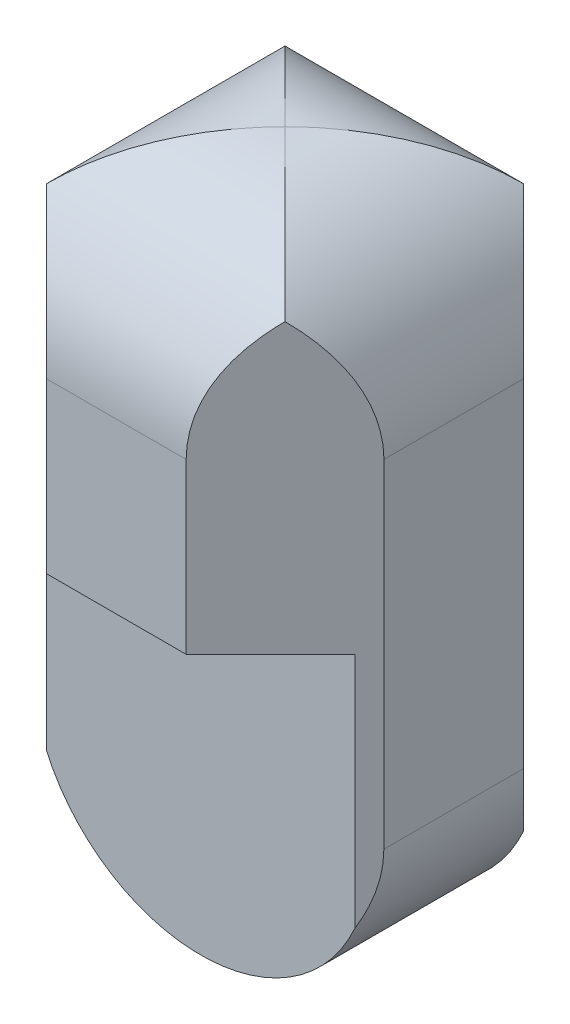
from build123d import *

# Parameters (mm, degrees)
EXTRUDE_1_DEPTH     = 48
CUT_EXTRUDE_1_DEPTH = 66
CUT_EXTRUDE_2_DEPTH = 5
CUT_EXTRUDE_START   = -5
CUT_EXTRUDE_3_DEPTH = 5
CUT_EXTRUDE_5_DEPTH = 30
CUT_EXTRUDE_6_DEPTH = 30


with BuildPart() as part:
    # 草图1 → 凸台-拉伸1 (new body)
    with BuildSketch(Plane(origin=(0, 0, 0), x_dir=(1, 0, 0), z_dir=(0, 1, 0))):
        Polygon((10, 4.142135624), (4.142135624, 10), (-4.142135624, 10), (-10, 4.142135624), (-10, -4.142135624), (-4.142135624, -10), (4.142135624, -10), (10, -4.142135624), align=None)
    extrude(amount=EXTRUDE_1_DEPTH)

    # 草图2 → 切除-拉伸1 (cut)
    with BuildSketch(Plane.XY.offset(10)):
        with BuildLine():
            Line((-10, 10), (-10, -2.389295552))
            Line((-10, -2.389295552), (10, -2.389295552))
            Line((10, -2.389295552), (10, 10))
            ThreePointArc((10, 10), (0, 0), (-10, 10))
        make_face()
    extrude(amount=-CUT_EXTRUDE_1_DEPTH, mode=Mode.SUBTRACT)

    # 草图4 → 切除-拉伸2 (cut)
    with BuildSketch(Plane.XY.offset(10)):
        with BuildLine():
            Line((-10, 10), (-10, 20))
            Line((-10, 20), (10, 20))
            Line((10, 20), (10, 10))
            ThreePointArc((10, 10), (0, 0), (-10, 10))
        make_face()
    extrude(amount=-CUT_EXTRUDE_2_DEPTH, mode=Mode.SUBTRACT)

    # 草图5 → 切除-拉伸3 (cut)
    with BuildSketch(Plane(origin=(0, 0, -10), x_dir=(-1, 0, 0), z_dir=(0, 0, -1)).offset(CUT_EXTRUDE_START)):
        with BuildLine():
            Line((-10, 10), (-10, 20))
            Line((-10, 20), (10, 20))
            Line((10, 20), (10, 10))
            ThreePointArc((10, 10), (0, 0), (-10, 10))
        make_face()
    extrude(amount=CUT_EXTRUDE_3_DEPTH, mode=Mode.SUBTRACT)

    # 草图7 → 切除-拉伸5 (cut)
    with BuildSketch(Plane.XY.offset(10)):
        with BuildLine():
            Line((-10, 30), (-10, 50.94058397))
            Line((-10, 50.94058397), (10, 50.94058397))
            Line((10, 50.94058397), (10, 30))
            ThreePointArc((10, 30), (0, 40), (-10, 30))
        make_face()
    extrude(amount=-CUT_EXTRUDE_5_DEPTH, mode=Mode.SUBTRACT)

    # 草图8 → 切除-拉伸6 (cut)
    with BuildSketch(Plane(origin=(10, 0, 0), x_dir=(0, 0, -1), z_dir=(1, 0, 0))):
        with BuildLine():
            Line((-10, 30), (-10, 44.07560735))
            Line((-10, 44.07560735), (10, 44.07560735))
            Line((10, 44.07560735), (10, 30))
            ThreePointArc((10, 30), (0, 40), (-10, 30))
        make_face()
    extrude(amount=-CUT_EXTRUDE_6_DEPTH, mode=Mode.SUBTRACT)


solid = part.part
